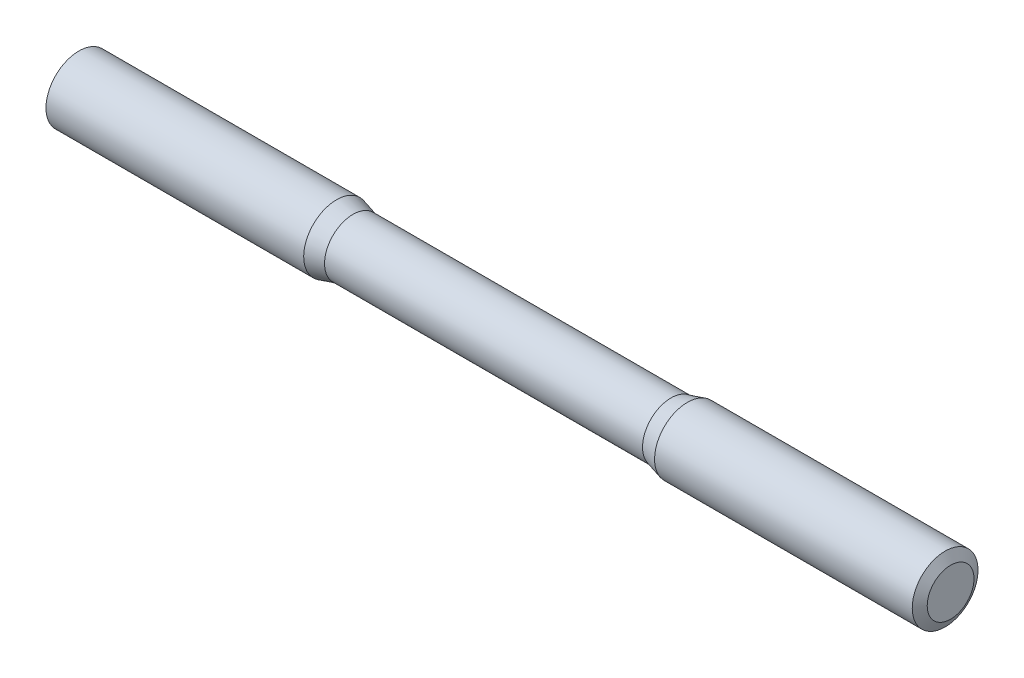
from build123d import *


with BuildPart() as part:
    # 草图1 → Revolve 558 (revolve)
    with BuildSketch(Plane.XY, mode=Mode.PRIVATE) as revolve_558_sk:
        Polygon((-20, 1.5), (-8, 1.5), (-7.25, 1.299), (7.25, 1.299), (8, 1.5), (20, 1.5), (20, 0), (-20, 0), align=None)
    revolve(revolve_558_sk.sketch.rotate(Axis((-20, 0, 0), (1, 0, 0)), 180), axis=Axis((-20, 0, 0), (1, 0, 0)))

    # 草图2 → Cut-Revolve 802 (revolve, cut)
    with BuildSketch(Plane.XY, mode=Mode.PRIVATE) as cut_revolve_802_sk:
        Polygon((-20.249992667, 1.5), (-19.750007333, 1.5), (-20, 1.067), align=None)
    cut_revolve_802 = revolve(cut_revolve_802_sk.sketch.rotate(Axis((-26.952426469, 0, 0), (1, 0, 0)), 180), axis=Axis((-26.952426469, 0, 0), (1, 0, 0)), mode=Mode.SUBTRACT)

    # 镜向1: Cut-Revolve 802 across plane
    add(cut_revolve_802.mirror(Plane(origin=(0, 0, 0), x_dir=(0, 0, 1), z_dir=(1, 0, 0))), mode=Mode.SUBTRACT)


solid = part.part
